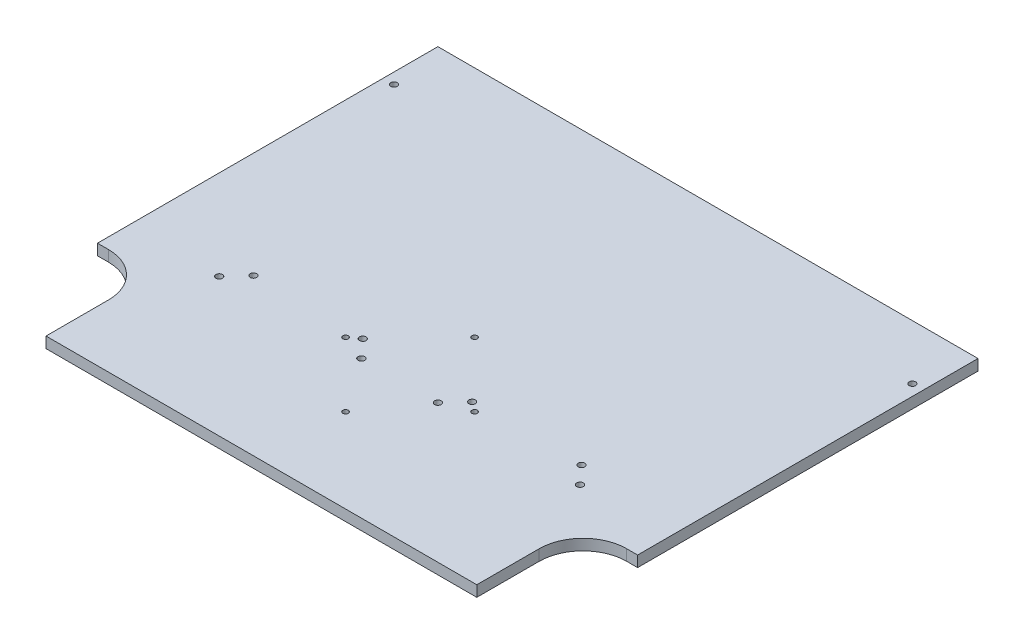
from build123d import *

# Parameters (mm, degrees)
BOSS_EXTRU_1_DEPTH      = 5
ESQUISSE2_R             = 1.5
ENL_V_MAT_EXTRU_1_DEPTH = 209.56953277
ESQUISSE4_R             = 1.25
ENL_V_MAT_EXTRU_3_DEPTH = 209.56953277
ESQUISSE5_R             = 1.5
ENL_V_MAT_EXTRU_6_DEPTH = 269.378676152


with BuildPart() as part:
    # Esquisse1 → Boss.-Extru.1 (new body)
    with BuildSketch(Plane(origin=(0, 0, 0), x_dir=(1, 0, 0), z_dir=(0, 1, 0))):
        with BuildLine():
            Line((123.5, -119.464880645), (123.5, 36.2))
            Line((123.5, 36.2), (-123.5, 36.2))
            Line((-123.5, 36.2), (-123.5, -119.464880645))
            Line((-123.5, -119.464880645), (-118.5, -119.464880645))
            ThreePointArc((-118.5, -119.464880645), (-104.357864376, -125.322745021), (-98.5, -139.464880645))
            Line((-98.5, -139.464880645), (-98.5, -168))
            Line((-98.5, -168), (98.5, -168))
            Line((98.5, -168), (98.5, -139.464880645))
            ThreePointArc((98.5, -139.464880645), (104.357864376, -125.322745021), (118.5, -119.464880645))
            Line((118.5, -119.464880645), (123.5, -119.464880645))
        make_face()
    extrude(amount=-BOSS_EXTRU_1_DEPTH)

    # Esquisse2 → Enlèv. mat.-Extru.1 (cut, through all)
    with BuildSketch(Plane(origin=(0, 0, 0), x_dir=(1, 0, 0), z_dir=(0, 1, 0))):
        with Locations(Location((-118.5, 11.2, 0), (0, 0, 270))):
            Circle(ESQUISSE2_R)
        with Locations(Location((118.5, 11.2, 0), (0, 0, 270))):
            Circle(ESQUISSE2_R)
    extrude(amount=-ENL_V_MAT_EXTRU_1_DEPTH, mode=Mode.SUBTRACT)

    # Esquisse4 → Enlèv. mat.-Extru.3 (cut, through all)
    with BuildSketch(Plane(origin=(0, 0, 0), x_dir=(1, 0, 0), z_dir=(0, 1, 0))):
        with Locations(Location((0, -129.5, 0), (0, 0, 270))):
            Circle(ESQUISSE4_R)
        with Locations(Location((29.5, -100, 0), (0, 0, 270))):
            Circle(ESQUISSE4_R)
        with Locations(Location((-29.5, -100, 0), (0, 0, 270))):
            Circle(ESQUISSE4_R)
        with Locations(Location((0, -70.5, 0), (0, 0, 270))):
            Circle(ESQUISSE4_R)
    extrude(amount=-ENL_V_MAT_EXTRU_3_DEPTH, mode=Mode.SUBTRACT)

    # Esquisse5 → Enlèv. mat.-Extru.6 (cut, through all)
    with BuildSketch(Plane(origin=(0, -179.424124514, 11.214007782), x_dir=(1, 0, 0), z_dir=(0, 0.9980525784828886, -0.06237828615518076))):
        with Locations(Location((-17.5, -104.583435434, 0), (0, 0, 270))):
            Circle(ESQUISSE5_R)
        with Locations(Location((-25, -96.451522388, 0), (0, 0, 270))):
            Circle(ESQUISSE5_R)
        with Locations(Location((-82.5, -104.583435434, 0), (0, 0, 270))):
            Circle(ESQUISSE5_R)
        with Locations(Location((-75, -96.451522388, 0), (0, 0, 270))):
            Circle(ESQUISSE5_R)
        with Locations(Location((17.5, -104.583435434, 0), (0, 0, 270))):
            Circle(ESQUISSE5_R)
        with Locations(Location((25, -96.451522388, 0), (0, 0, 270))):
            Circle(ESQUISSE5_R)
        with Locations(Location((75, -96.451522388, 0), (0, 0, 270))):
            Circle(ESQUISSE5_R)
        with Locations(Location((82.5, -104.583435434, 0), (0, 0, 270))):
            Circle(ESQUISSE5_R)
    extrude(amount=ENL_V_MAT_EXTRU_6_DEPTH, mode=Mode.SUBTRACT)


solid = part.part
